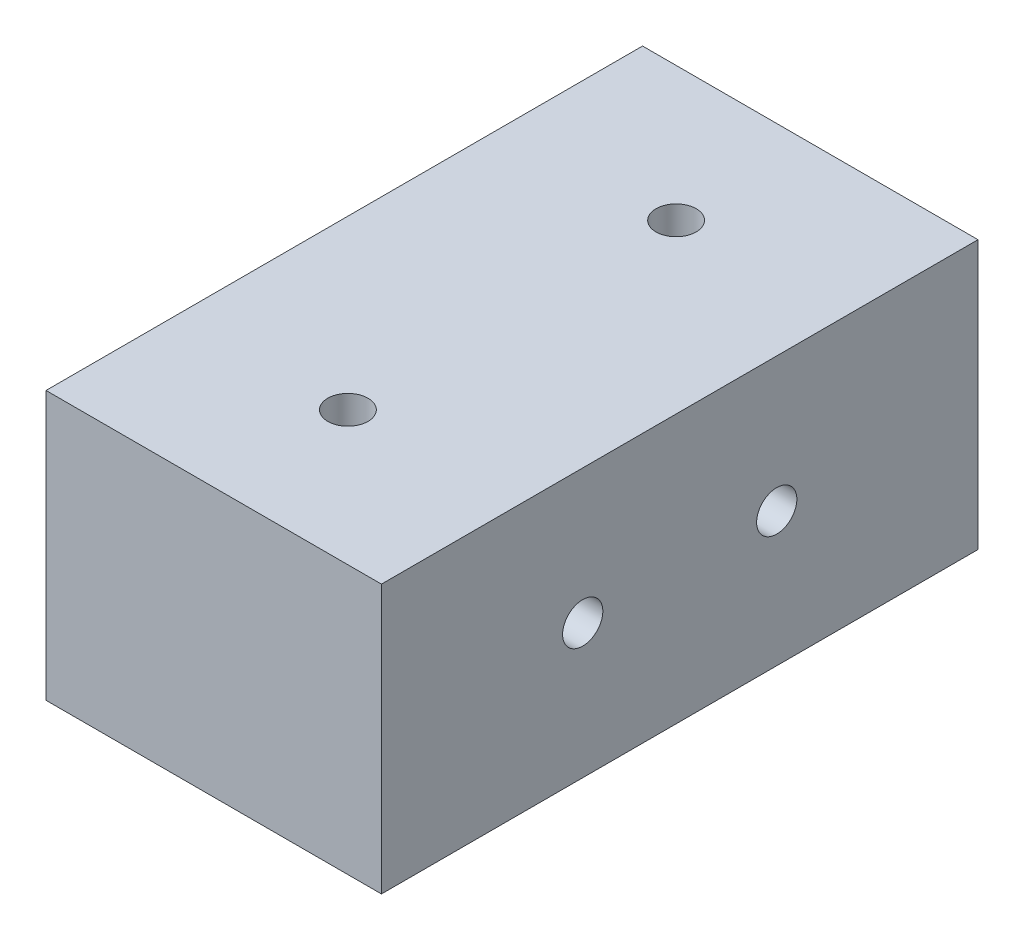
from build123d import *

# Parameters (mm, degrees)
CROQUIS2_W              = 44.460320701
CROQUIS2_H              = 20
SALIENTE_EXTRUIR2_DEPTH = 25
CROQUIS3_R              = 1.5
CORTAR_EXTRUIR1_DEPTH   = 55.787955947
CROQUIS4_R              = 1.5
CORTAR_EXTRUIR2_DEPTH   = 50


with BuildPart() as part:
    # Croquis2 → Saliente-Extruir2 (new body)
    with BuildSketch(Plane(origin=(0, 0, 0), x_dir=(0, 0, -1), z_dir=(1, 0, 0))):
        with Locations((-22.230160351, -10)):
            Rectangle(CROQUIS2_W, CROQUIS2_H)
    extrude(amount=SALIENTE_EXTRUIR2_DEPTH)

    # Croquis3 → Cortar-Extruir1 (cut, through all)
    with BuildSketch(Plane.XZ.offset(20)):
        with Locations(Location((12.5, 10, 0), (0, 0, 270))):
            Circle(CROQUIS3_R)
        with Locations(Location((12.5, 34.460320701, 0), (0, 0, 270))):
            Circle(CROQUIS3_R)
    extrude(amount=-CORTAR_EXTRUIR1_DEPTH, mode=Mode.SUBTRACT)

    # Croquis4 → Cortar-Extruir2 (cut)
    with BuildSketch(Plane(origin=(25, 0, 0), x_dir=(0, 0, -1), z_dir=(1, 0, 0))):
        with Locations((-29.460320701, -10)):
            Circle(CROQUIS4_R)
        with Locations((-15, -10)):
            Circle(CROQUIS4_R)
    extrude(amount=-CORTAR_EXTRUIR2_DEPTH, mode=Mode.SUBTRACT)


solid = part.part
